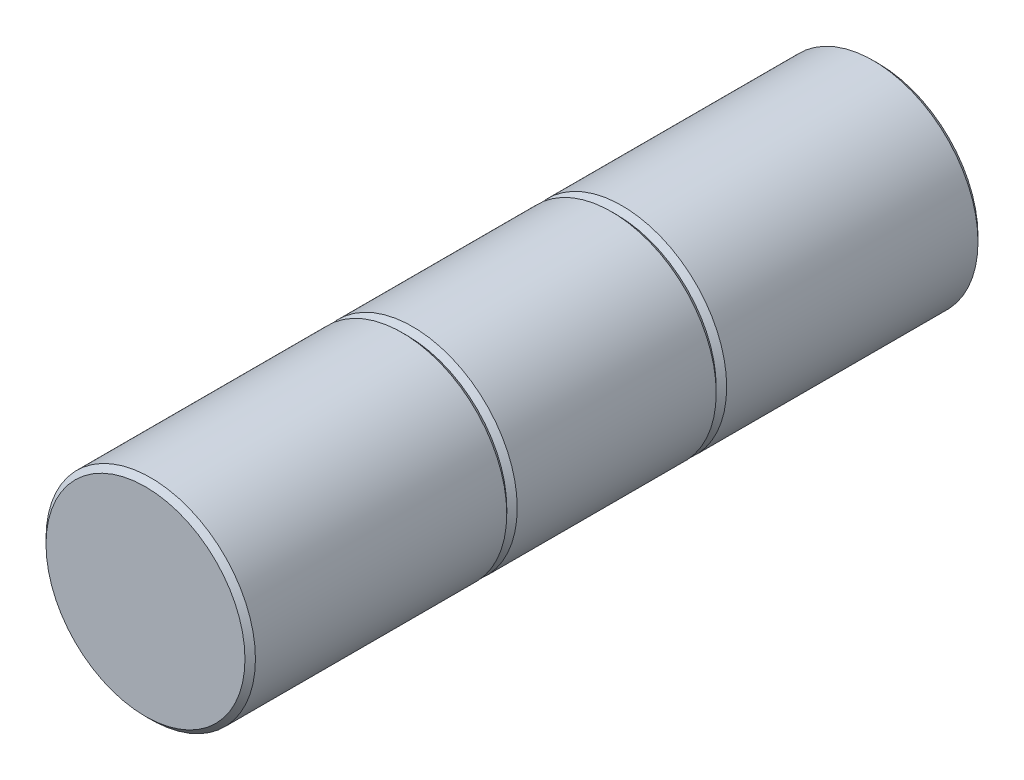
from build123d import *

# Parameters (mm, degrees)
SKETCH2_R           = 2
BOSS_EXTRUDE1_DEPTH = 2
SKETCH3_R           = 2
BOSS_EXTRUDE2_DEPTH = 5
SKETCH4_R           = 2
BOSS_EXTRUDE3_DEPTH = 5
CHAMFER1_SIZE       = 0.1
CHAMFER2_SIZE       = 0.1
CHAMFER3_SIZE       = 0.1


with BuildPart() as part:
    # Sketch2 → Boss-Extrude1 (new, symmetric)
    with BuildSketch(Plane.XY):
        Circle(SKETCH2_R)
    extrude(amount=BOSS_EXTRUDE1_DEPTH, both=True)

    # Chamfer3
    chamfer3_edges = [part.edges().sort_by_distance(p)[0] for p in [
        (-2, 0, -2),
        (-2, 0, 2),
    ]]
    chamfer(chamfer3_edges, length=CHAMFER3_SIZE)


with BuildPart() as body_2:
    # Sketch3 → Boss-Extrude2 (new body)
    with BuildSketch(Plane.XY.offset(2)):
        Circle(SKETCH3_R)
    extrude(amount=BOSS_EXTRUDE2_DEPTH)

    # Chamfer1
    chamfer1_edges = [body_2.edges().sort_by_distance(p)[0] for p in [
        (-2, 0, 2),
        (-2, 0, 7),
    ]]
    chamfer(chamfer1_edges, length=CHAMFER1_SIZE)


with BuildPart() as body_3:
    # Sketch4 → Boss-Extrude3 (new body)
    with BuildSketch(Plane(origin=(0, 0, -2), x_dir=(-1, 0, 0), z_dir=(0, 0, -1))):
        Circle(SKETCH4_R)
    extrude(amount=BOSS_EXTRUDE3_DEPTH)

    # Chamfer2
    chamfer2_edges = [body_3.edges().sort_by_distance(p)[0] for p in [
        (2, 0, -2),
        (2, 0, -7),
    ]]
    chamfer(chamfer2_edges, length=CHAMFER2_SIZE)


solid = Compound([part.part, body_2.part, body_3.part])
